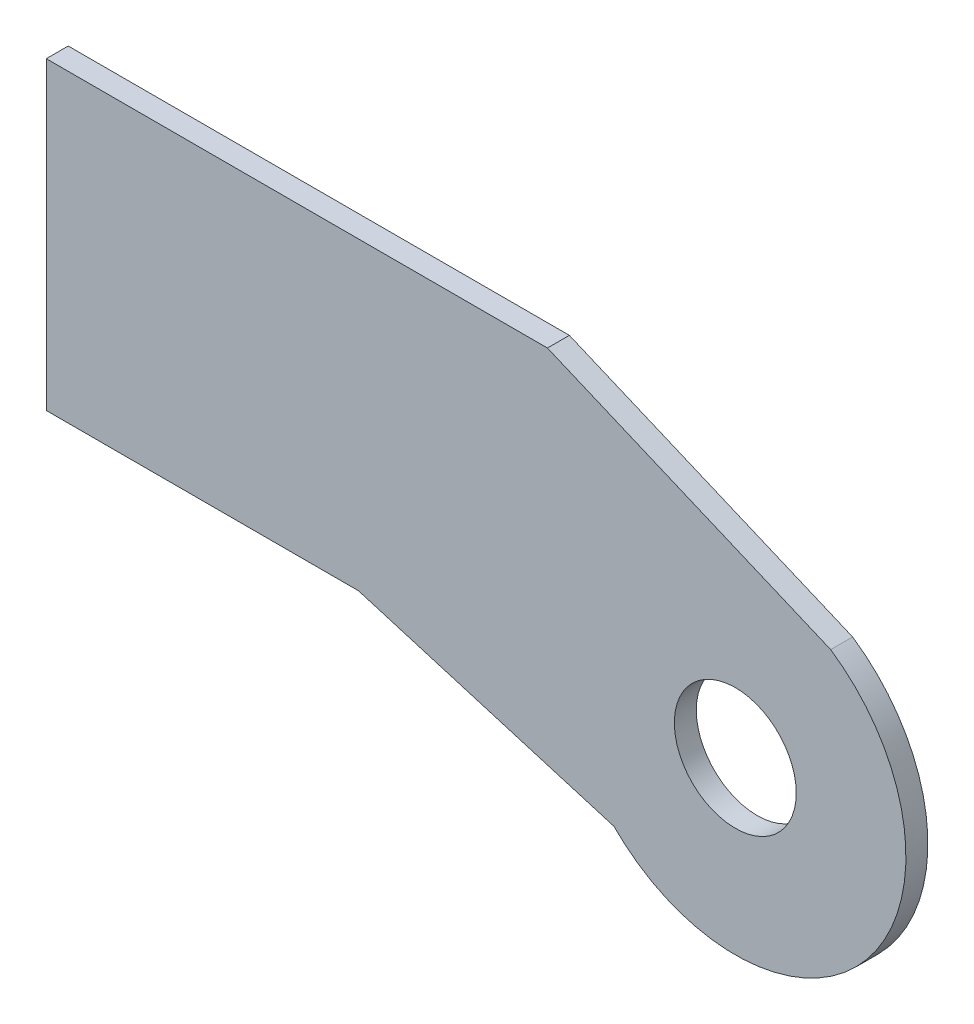
from build123d import *

# Parameters (mm, degrees)
RESSALTO_EXTRUS_O3_DEPTH = 1.8
ESBO_O7_R                = 5
CORTE_EXTRUS_O5_DEPTH    = 3


with BuildPart() as part:
    # Esboço1 → Ressalto-extrusão3 (new body)
    with BuildSketch(Plane.XY):
        with BuildLine():
            Line((-15.780332987, 15.405349819), (25.337197849, 15.405349819))
            Line((25.337197849, 15.405349819), (48.575213244, 5.595781738))
            ThreePointArc((48.575213244, 5.595781738), (51.52798537, -14.949789194), (30.790948881, -15.852377581))
            Line((30.790948881, -15.852377581), (9.828194525, -9.594650181))
            Line((9.828194525, -9.594650181), (-15.780332987, -9.594650181))
            Line((-15.780332987, -9.594650181), (-15.780332987, 15.405349819))
        make_face()
    extrude(amount=RESSALTO_EXTRUS_O3_DEPTH)

    # Esboço7 → Corte-extrusão5 (cut)
    with BuildSketch(Plane.XY.offset(1.8)):
        with Locations((40.750876667, -6.013686688)):
            Circle(ESBO_O7_R)
    extrude(amount=-CORTE_EXTRUS_O5_DEPTH, mode=Mode.SUBTRACT)


solid = part.part
